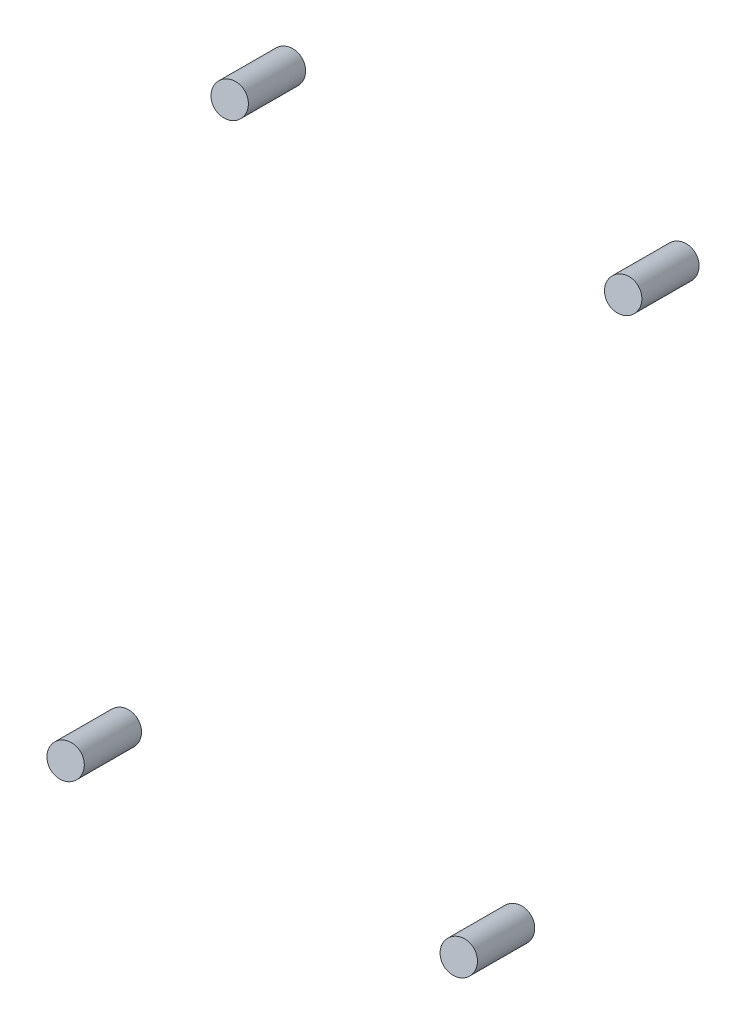
from build123d import *

# Parameters (mm, degrees)
SKETCH1_R             = 2
BOSS_EXTRUDE1_DEPTH   = 10
BOSS_EXTRUDE1_2_DEPTH = 10
BOSS_EXTRUDE1_3_DEPTH = 10
BOSS_EXTRUDE1_4_DEPTH = 10


with BuildPart() as part:
    # Sketch1 → Boss-Extrude1 (new body)
    with BuildSketch(Plane(origin=(-87.670750421, -88.346358292, -389.516222441), x_dir=(0.9767466531434608, -0.04742294041249508, -0.20908620302564437), z_dir=(0.21439677136805962, 0.2160489546300463, 0.9525528193387578))):
        with Locations(Location((229.711450769, 309.233210883, 0), (0, 0, 270))):
            Circle(SKETCH1_R)
    extrude(amount=BOSS_EXTRUDE1_DEPTH)


with BuildPart() as body_2:
    # Sketch1 → Boss-Extrude1 2 (new body)
    with BuildSketch(Plane(origin=(-87.670750421, -88.346358292, -389.516222441), x_dir=(0.9767466531434608, -0.04742294041249508, -0.20908620302564437), z_dir=(0.21439677136805962, 0.2160489546300463, 0.9525528193387578))):
        with Locations(Location((273.051869753, 306.380744005, 0), (0, 0, 270))):
            Circle(SKETCH1_R)
    extrude(amount=BOSS_EXTRUDE1_2_DEPTH)


with BuildPart() as body_3:
    # Sketch1 → Boss-Extrude1 3 (new body)
    with BuildSketch(Plane(origin=(-87.670750421, -88.346358292, -389.516222441), x_dir=(0.9767466531434608, -0.04742294041249508, -0.20908620302564437), z_dir=(0.21439677136805962, 0.2160489546300463, 0.9525528193387578))):
        with Locations(Location((224.902969442, 239.294313813, 0), (0, 0, 270))):
            Circle(SKETCH1_R)
    extrude(amount=BOSS_EXTRUDE1_3_DEPTH)


with BuildPart() as body_4:
    # Sketch1 → Boss-Extrude1 4 (new body)
    with BuildSketch(Plane(origin=(-87.670750421, -88.346358292, -389.516222441), x_dir=(0.9767466531434608, -0.04742294041249508, -0.20908620302564437), z_dir=(0.21439677136805962, 0.2160489546300463, 0.9525528193387578))):
        with Locations(Location((268.234677409, 236.315146035, 0), (0, 0, 270))):
            Circle(SKETCH1_R)
    extrude(amount=BOSS_EXTRUDE1_4_DEPTH)


solid = Compound([part.part, body_2.part, body_3.part, body_4.part])
